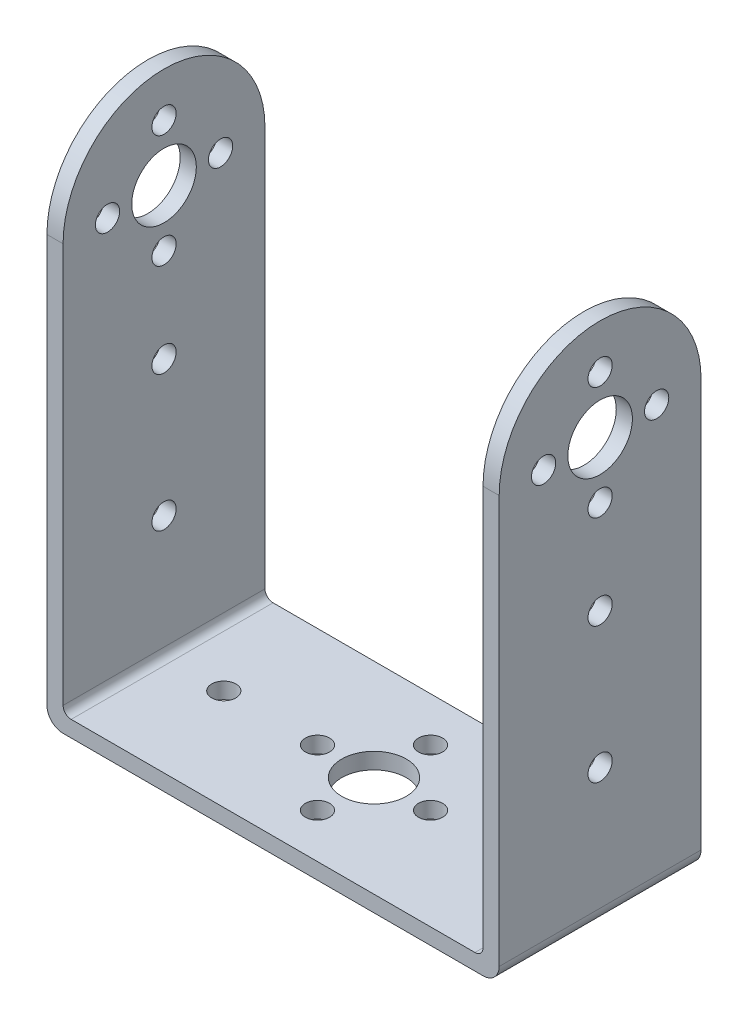
from build123d import *

# Parameters (mm, degrees)
EXTRUDE_1_DEPTH           = 56
SKETCH_2_W                = 52
SKETCH_2_H                = 100
CUT_EXTRUDE_1_DEPTH       = 88.562834582
HOLE_WIZARD_8_0_8_1_D     = 8
HOLE_WIZARD_8_0_8_1_DEPTH = 2
HOLE_WIZARD_8_0_8_2_D     = 8
HOLE_WIZARD_3_0_3_1_D     = 3
HOLE_WIZARD_3_0_3_1_DEPTH = 2
HOLE_WIZARD_3_0_3_2_D     = 3
HOLE_WIZARD_3_0_3_3_D     = 3
HOLE_WIZARD_8_0_8_3_D     = 8
FILLET_1_R                = 1
FILLET_2_R                = 2


with BuildPart() as part:
    # 草图1 → 凸台-拉伸1 (new body)
    with BuildSketch(Plane(origin=(56, 0, 0), x_dir=(0, 0, -1), z_dir=(1, 0, 0))):
        with BuildLine():
            Line((-25, 50), (-25, -2.5))
            Line((-25, -2.5), (0, -2.5))
            Line((0, -2.5), (0, 50))
            ThreePointArc((0, 50), (-12.5, 62.5), (-25, 50))
        make_face()
    extrude(amount=-EXTRUDE_1_DEPTH)

    # 草图2 → 切除-拉伸1 (cut, through all)
    with BuildSketch(Plane.XY.offset(25)):
        with Locations((28, 49.5)):
            Rectangle(SKETCH_2_W, SKETCH_2_H)
    extrude(amount=-CUT_EXTRUDE_1_DEPTH, mode=Mode.SUBTRACT)

    # Ø8.0 (8) 直径孔1
    with Locations(Plane(origin=(56, 0, 0), x_dir=(0, 0, -1), z_dir=(1, 0, 0))):
        with Locations((-12.5, 50)):
            Hole(HOLE_WIZARD_8_0_8_1_D / 2, depth=HOLE_WIZARD_8_0_8_1_DEPTH)

    # Ø8.0 (8) 直径孔2 (through all)
    with Locations(Plane(origin=(2, 0, 0), x_dir=(0, 0, -1), z_dir=(1, 0, 0))):
        with Locations((-12.5, 50)):
            Hole(HOLE_WIZARD_8_0_8_2_D / 2)

    # Ø3.0 (3) 直径孔1
    with Locations(Plane(origin=(56, 0, 0), x_dir=(0, 0, -1), z_dir=(1, 0, 0))):
        with Locations((-5.5, 50), (-12.5, 57), (-12.5, 31.4), (-12.5, 43), (-19.5, 50), (-12.5, 14.6)):
            Hole(HOLE_WIZARD_3_0_3_1_D / 2, depth=HOLE_WIZARD_3_0_3_1_DEPTH)

    # Ø3.0 (3) 直径孔2 (through all)
    with Locations(Plane(origin=(2, 0, 0), x_dir=(0, 0, -1), z_dir=(1, 0, 0))):
        with Locations((-5.5, 50), (-12.5, 57), (-12.5, 31.4), (-12.5, 43), (-19.5, 50), (-12.5, 14.6)):
            Hole(HOLE_WIZARD_3_0_3_2_D / 2)

    # Ø3.0 (3) 直径孔3 (through all)
    with Locations(Plane(origin=(0, -2.5, 0), x_dir=(-1, 0, 0), z_dir=(0, -1, 0))):
        with Locations((-46.6, -12.5), (-21, -12.5), (-35, -12.5), (-9.4, -12.5), (-28, -19.5), (-28, -5.5)):
            Hole(HOLE_WIZARD_3_0_3_3_D / 2)

    # Ø8.0 (8) 直径孔3 (through all)
    with Locations(Plane(origin=(0, -2.5, 0), x_dir=(-1, 0, 0), z_dir=(0, -1, 0))):
        with Locations((-28, -12.5)):
            Hole(HOLE_WIZARD_8_0_8_3_D / 2)

    # 圆角1
    fillet_1_edges = [part.edges().sort_by_distance(p)[0] for p in [
        (54, -0.5, 12.5),
        (2, -0.5, 12.5),
    ]]
    fillet(fillet_1_edges, radius=FILLET_1_R)

    # 圆角2
    fillet_2_edges = [part.edges().sort_by_distance(p)[0] for p in [
        (0, -2.5, 12.5),
        (56, -2.5, 12.5),
    ]]
    fillet(fillet_2_edges, radius=FILLET_2_R)


solid = part.part
